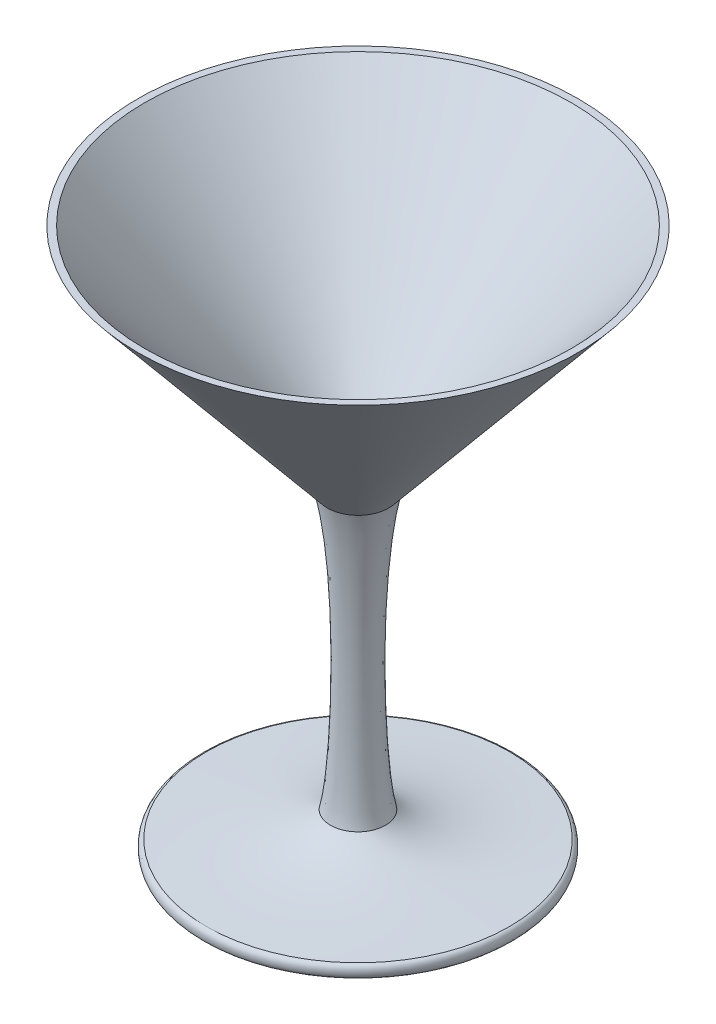
from build123d import *


with BuildPart() as part:
    # Szkic1 → Obrót1 (revolve)
    with BuildSketch(Plane.XY, mode=Mode.PRIVATE) as obr_t1_sk:
        with BuildLine():
            Line((-159.420742679, -336.877488131), (-191.088174173, -336.877488131))
            add(Edge.make_bspline(
                [(-190.964645188, -334.304345553), (-192.193047533, -334.611123181), (-191.925483576, -336.882848477), (-191.088174173, -336.877488131)],
                knots=[0, 0, 0, 0, 0.19597938, 0.19597938, 0.19597938, 0.19597938], degree=3))
            add(Edge.make_bspline(
                [(-165.144069859, -328.953295048), (-169.837453966, -333.171753818), (-179.536145115, -333.828520522), (-190.964645188, -334.304345553)],
                knots=[0, 0, 0, 0, 0.834301138, 0.834301138, 0.834301138, 0.834301138], degree=3))
            add(Edge.make_bspline(
                [(-165.810340985, -271.404559169), (-162.204633443, -287.930293232), (-163.22774831, -321.791320533), (-165.144069859, -328.953295048)],
                knots=[0, 0, 0, 0, 1, 1, 1, 1], degree=3))
            Line((-165.810340985, -271.404559169), (-205.238115586, -223.671915039))
            Line((-205.238115586, -223.671915039), (-203.806854139, -223.671915039))
            Line((-203.806854139, -223.671915039), (-164.1921091, -268.411235001))
            ThreePointArc((-164.1921091, -268.411235001), (-161.976515627, -269.770631147), (-159.420742679, -270.244800904))
            Line((-159.420742679, -270.244800904), (-159.420742679, -336.877488131))
        make_face()
    revolve(obr_t1_sk.sketch.rotate(Axis((-159.420742679, -270.244800904, 0), (0, -1, 0)), 270), axis=Axis((-159.420742679, -270.244800904, 0), (0, -1, 0)))


solid = part.part
